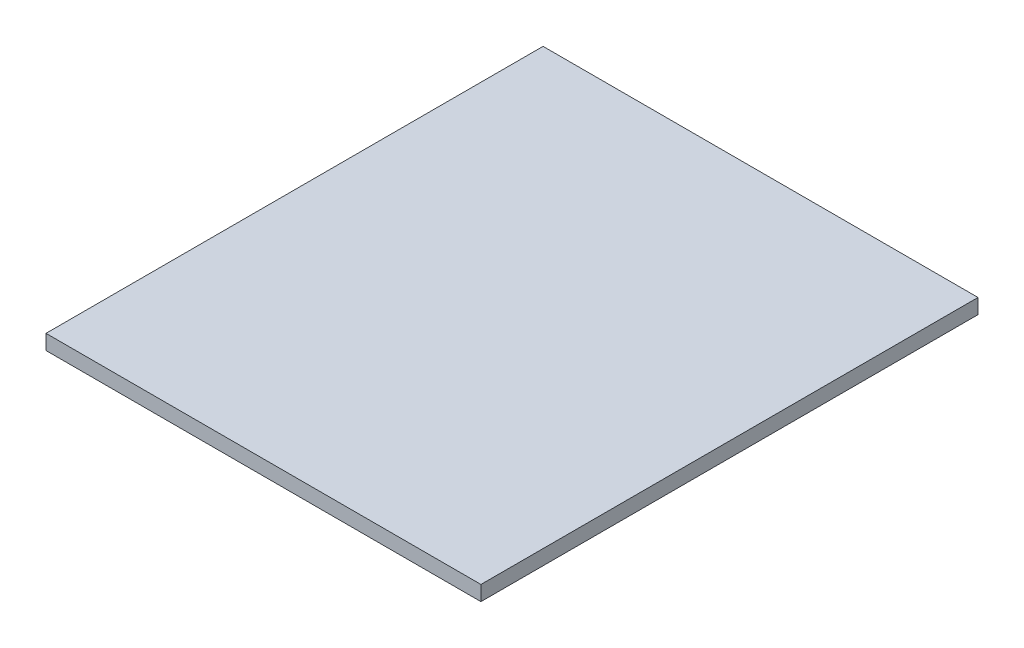
from build123d import *

# Parameters (mm, degrees)
SKETCH_1_W      = 700
SKETCH_1_H      = 800
EXTRUDE_1_DEPTH = 24


with BuildPart() as part:
    # Эскиз1 → Бобышка-Вытянуть1 (new body)
    with BuildSketch(Plane(origin=(0, 0, 0), x_dir=(1, 0, 0), z_dir=(0, 1, 0))):
        with Locations((288.758841841, -350.316283836)):
            Rectangle(SKETCH_1_W, SKETCH_1_H)
    extrude(amount=EXTRUDE_1_DEPTH)


solid = part.part
